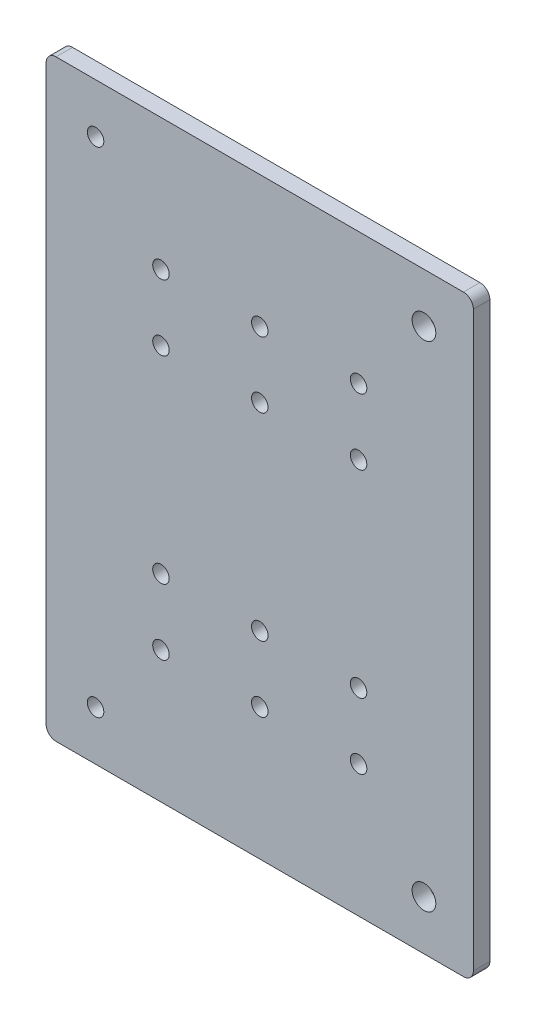
from build123d import *

# Parameters (mm, degrees)
SKETCH1_W           = 129.7
SKETCH1_H           = 180
SKETCH1_R           = 2.5
SKETCH1_R_2         = 3.6
BOSS_EXTRUDE1_DEPTH = 5
FILLET1_R           = 3


with BuildPart() as part:
    # Sketch1 → Boss-Extrude1 (new body)
    with BuildSketch(Plane.XY):
        with Locations((64.85, 90)):
            Rectangle(SKETCH1_W, SKETCH1_H)
        with Locations((15, 15)):
            Circle(SKETCH1_R, mode=Mode.SUBTRACT)
        with Locations((15, 165)):
            Circle(SKETCH1_R, mode=Mode.SUBTRACT)
        with Locations((114.7, 165)):
            Circle(SKETCH1_R_2, mode=Mode.SUBTRACT)
        with Locations((114.7, 15)):
            Circle(SKETCH1_R_2, mode=Mode.SUBTRACT)
        with Locations((34.85, 140)):
            Circle(SKETCH1_R, mode=Mode.SUBTRACT)
        with Locations((64.85, 140)):
            Circle(SKETCH1_R, mode=Mode.SUBTRACT)
        with Locations((94.85, 140)):
            Circle(SKETCH1_R, mode=Mode.SUBTRACT)
        with Locations((34.85, 40)):
            Circle(SKETCH1_R, mode=Mode.SUBTRACT)
        with Locations((64.85, 40)):
            Circle(SKETCH1_R, mode=Mode.SUBTRACT)
        with Locations((94.85, 40)):
            Circle(SKETCH1_R, mode=Mode.SUBTRACT)
        with Locations((94.85, 120)):
            Circle(SKETCH1_R, mode=Mode.SUBTRACT)
        with Locations((64.85, 120)):
            Circle(SKETCH1_R, mode=Mode.SUBTRACT)
        with Locations((34.85, 120)):
            Circle(SKETCH1_R, mode=Mode.SUBTRACT)
        with Locations((34.85, 60)):
            Circle(SKETCH1_R, mode=Mode.SUBTRACT)
        with Locations((64.85, 60)):
            Circle(SKETCH1_R, mode=Mode.SUBTRACT)
        with Locations((94.85, 60)):
            Circle(SKETCH1_R, mode=Mode.SUBTRACT)
    extrude(amount=BOSS_EXTRUDE1_DEPTH)

    # Fillet1
    fillet1_edges = [part.edges().sort_by_distance(p)[0] for p in [
        (0, 180, 2.5),
        (129.7, 180, 2.5),
        (129.7, 0, 2.5),
        (0, 0, 2.5),
    ]]
    fillet(fillet1_edges, radius=FILLET1_R)


solid = part.part
